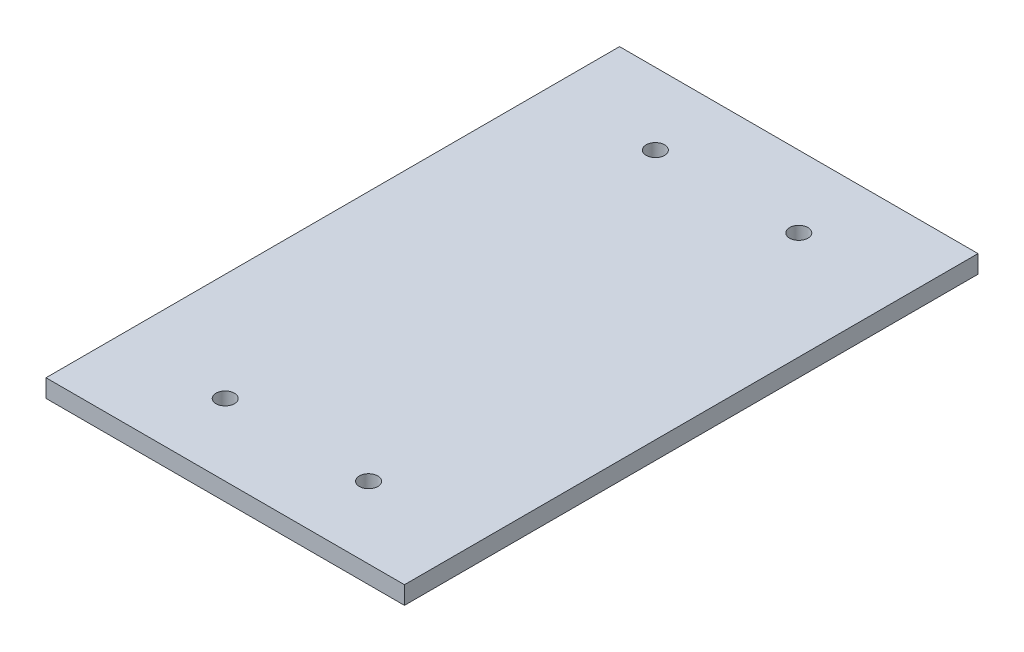
from build123d import *

# Parameters (mm, degrees)
SKETCH1_W                = 127
SKETCH1_H                = 203.2
BOSS_EXTRUDE1_DEPTH      = 6.35
F_5_16_18_TAPPED_HOLE1_D = 6.5278


with BuildPart() as part:
    # Sketch1 → Boss-Extrude1 (new body)
    with BuildSketch(Plane(origin=(0, 0, 0), x_dir=(1, 0, 0), z_dir=(0, 1, 0))):
        Rectangle(SKETCH1_W, SKETCH1_H)
    extrude(amount=BOSS_EXTRUDE1_DEPTH)

    # 5/16-18 Tapped Hole1 (through all)
    with Locations(Plane(origin=(0, 6.35, 0), x_dir=(1, 0, 0), z_dir=(0, 1, 0))):
        with Locations((-25.4, 76.2), (25.4, 76.2), (25.4, -76.2), (-25.4, -76.2)):
            Hole(F_5_16_18_TAPPED_HOLE1_D / 2)


solid = part.part
